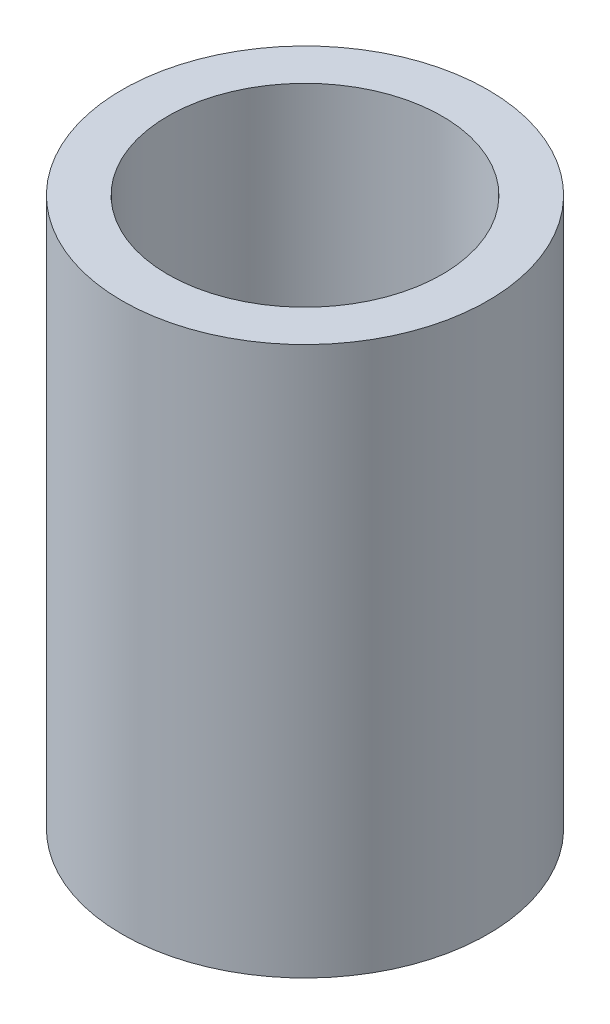
from build123d import *

# Parameters (mm, degrees)
ESQUISSE1_R             = 20
BOSS_EXTRU_1_DEPTH      = 60
ESQUISSE2_R             = 15
ENL_V_MAT_EXTRU_1_DEPTH = 55


with BuildPart() as part:
    # Esquisse1 → Boss.-Extru.1 (new body)
    with BuildSketch(Plane(origin=(0, 0, 0), x_dir=(1, 0, 0), z_dir=(0, 1, 0))):
        with Locations(Location((0, 0, 0), (0, 0, 270))):
            Circle(ESQUISSE1_R)
    extrude(amount=BOSS_EXTRU_1_DEPTH)

    # Esquisse2 → Enlèv. mat.-Extru.1 (cut)
    with BuildSketch(Plane(origin=(0, 60, 0), x_dir=(1, 0, 0), z_dir=(0, 1, 0))):
        with Locations(Location((0, 0, 0), (0, 0, 270))):
            Circle(ESQUISSE2_R)
    extrude(amount=-ENL_V_MAT_EXTRU_1_DEPTH, mode=Mode.SUBTRACT)


solid = part.part
